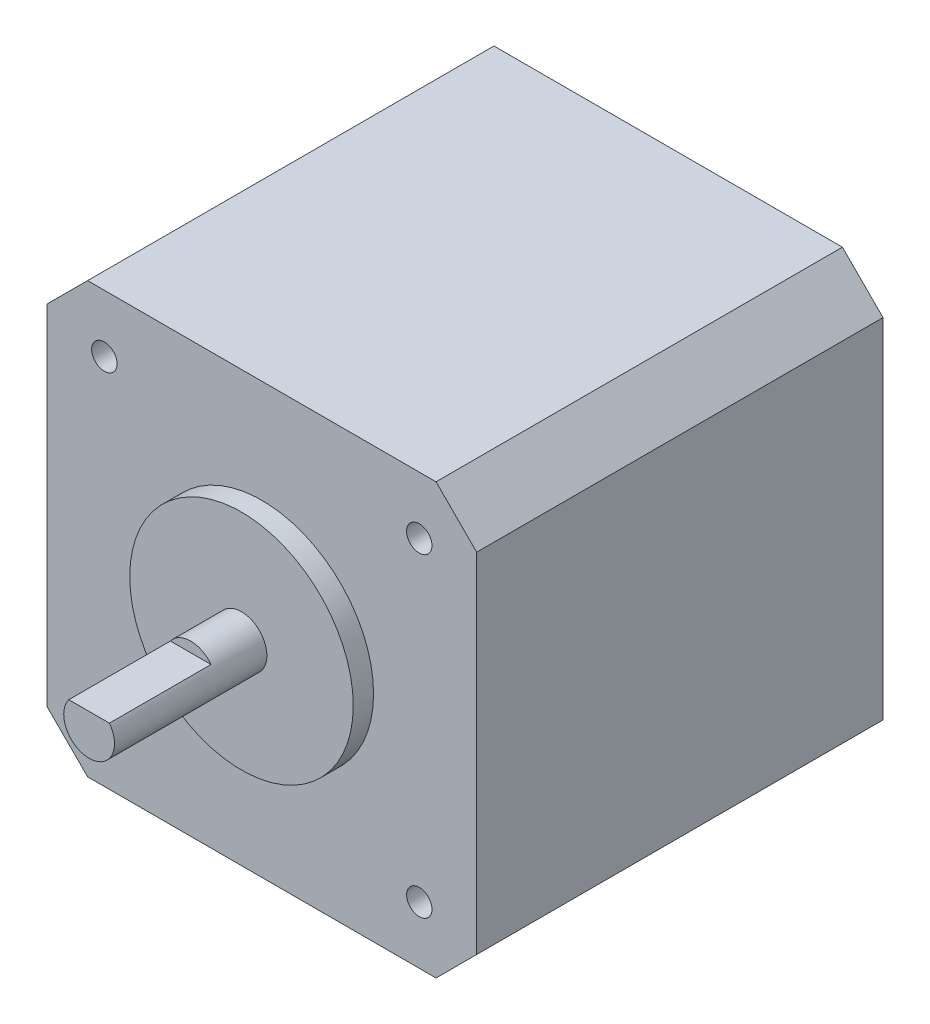
from build123d import *

# Parameters (mm, degrees)
SKETCH_1_W             = 42.3
SKETCH_1_H             = 42.3
EXTRUDE_1_DEPTH        = 40
SKETCH_2_R             = 11
EXTRUDE_2_DEPTH        = 2
SKETCH_3_R             = 2.5
EXTRUDE_3_DEPTH        = 15
SKETCH_4_W             = 22.313934425
SKETCH_4_H             = 9.701954983
CUT_EXTRUDE_1_DEPTH    = 11
CHAMFER_1_SIZE         = 4
HOLE_WIZARD_M3_1_D     = 2.5
HOLE_WIZARD_M3_1_DEPTH = 7.5
HOLE_WIZARD_M3_1_TIP   = 0.751075774


with BuildPart() as part:
    # 草图1 → 凸台-拉伸1 (new body)
    with BuildSketch(Plane.XY):
        Rectangle(SKETCH_1_W, SKETCH_1_H)
    extrude(amount=EXTRUDE_1_DEPTH)

    # 草图2 → 凸台-拉伸2 (add)
    with BuildSketch(Plane.XY.offset(40)):
        Circle(SKETCH_2_R)
    extrude(amount=EXTRUDE_2_DEPTH)

    # 草图3 → 凸台-拉伸3 (add)
    with BuildSketch(Plane.XY.offset(42)):
        Circle(SKETCH_3_R)
    extrude(amount=EXTRUDE_3_DEPTH)

    # 草图4 → 切除-拉伸1 (cut, symmetric)
    with BuildSketch(Plane(origin=(0, 0, 0), x_dir=(0, 0, -1), z_dir=(1, 0, 0))):
        with Locations((-58.156967212, 6.350977492)):
            Rectangle(SKETCH_4_W, SKETCH_4_H)
    extrude(amount=CUT_EXTRUDE_1_DEPTH, both=True, mode=Mode.SUBTRACT)

    # 倒角1
    chamfer_1_edges = [part.edges().sort_by_distance(p)[0] for p in [
        (21.15, -21.15, 20),
        (-21.15, -21.15, 20),
        (-21.15, 21.15, 20),
        (21.15, 21.15, 20),
    ]]
    chamfer(chamfer_1_edges, length=CHAMFER_1_SIZE)

    # M3 螺纹孔1
    with Locations(Plane.XY.offset(40)):
        with Locations((-15.5, 15.5), (-15.5, -15.5), (15.5, -15.5), (15.5, 15.5)):
            Hole(HOLE_WIZARD_M3_1_D / 2, depth=HOLE_WIZARD_M3_1_DEPTH)
            with Locations((0, 0, -(HOLE_WIZARD_M3_1_DEPTH + HOLE_WIZARD_M3_1_TIP / 2))):  # 118° drill point
                Cone(0, HOLE_WIZARD_M3_1_D / 2, HOLE_WIZARD_M3_1_TIP, mode=Mode.SUBTRACT)


solid = part.part
